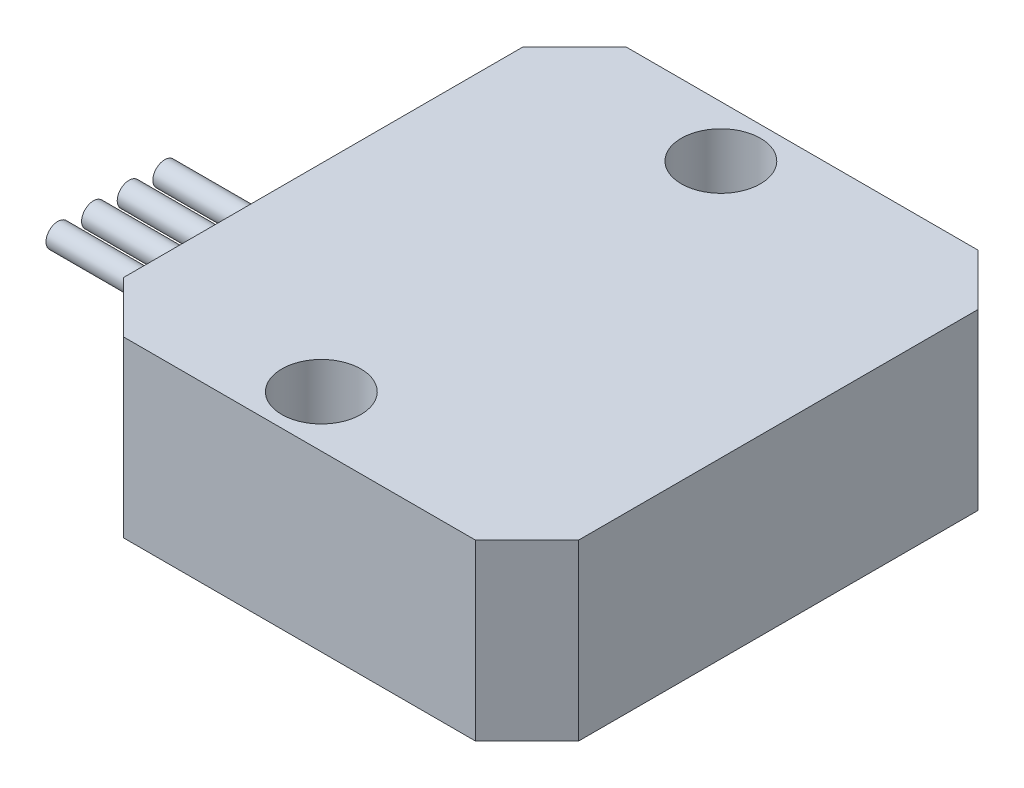
from build123d import *

# Parameters (mm, degrees)
SKETCH1_R             = 5
BASE_DEPTH            = 22
SKETCH2_W             = 27.5
SKETCH2_H             = 14.5
WIRE_INSERTIONS_DEPTH = 1.8
SKETCH3_R             = 1.5
GND_WIRES_DEPTH       = 25
SKETCH4_R             = 1.5
OUTPUT_WIRE_DEPTH     = 25
SKETCH5_R             = 1.5
INPUT_WIRE_DEPTH      = 25


with BuildPart() as part:
    # Sketch1 → Base (new body)
    with BuildSketch(Plane(origin=(0, 0, 0), x_dir=(1, 0, 0), z_dir=(0, 1, 0))):
        Polygon((22.25, -31.75), (-22.25, -31.75), (-28.75, -25.25), (-28.75, 25.25), (-22.25, 31.75), (22.25, 31.75), (28.75, 25.25), (28.75, -25.25), align=None)
        with Locations(Location((-3.75, -25.25, 0), (0, 0, 270))):
            Circle(SKETCH1_R, mode=Mode.SUBTRACT)
        with Locations(Location((-3.75, 25.25, 0), (0, 0, 270))):
            Circle(SKETCH1_R, mode=Mode.SUBTRACT)
    extrude(amount=BASE_DEPTH)

    # Sketch2 → Wire Insertions (add)
    with BuildSketch(Plane.ZY.offset(28.75)):
        with Locations((0, 7.25)):
            Rectangle(SKETCH2_W, SKETCH2_H)
    extrude(amount=WIRE_INSERTIONS_DEPTH)

    # Sketch3 → GND Wires (add)
    with BuildSketch(Plane.ZY.offset(30.55)):
        with Locations(Location((-2.25, 4, 0), (0, 0, 180))):
            Circle(SKETCH3_R)
        with Locations(Location((2.25, 4, 0), (0, 0, 180))):
            Circle(SKETCH3_R)
    extrude(amount=GND_WIRES_DEPTH)

    # Sketch4 → Output Wire (add)
    with BuildSketch(Plane.ZY.offset(30.55)):
        with Locations(Location((-6.75, 4, 0), (0, 0, 180))):
            Circle(SKETCH4_R)
    extrude(amount=OUTPUT_WIRE_DEPTH)

    # Sketch5 → Input Wire (add)
    with BuildSketch(Plane.ZY.offset(30.55)):
        with Locations(Location((6.75, 4, 0), (0, 0, 180))):
            Circle(SKETCH5_R)
    extrude(amount=INPUT_WIRE_DEPTH)


solid = part.part
